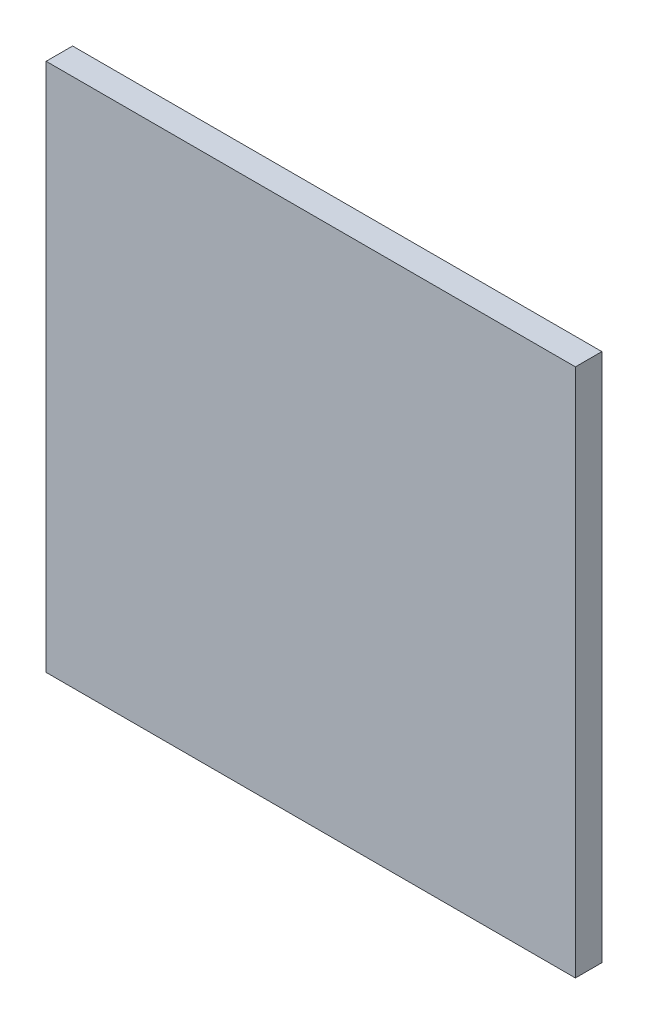
from build123d import *

# Parameters (mm, degrees)
SKETCH1_W           = 80
SKETCH1_H           = 80
BOSS_EXTRUDE1_DEPTH = 4


with BuildPart() as part:
    # Sketch1 → Boss-Extrude1 (new body)
    with BuildSketch(Plane.XY):
        Rectangle(SKETCH1_W, SKETCH1_H)
    extrude(amount=BOSS_EXTRUDE1_DEPTH)


solid = part.part
